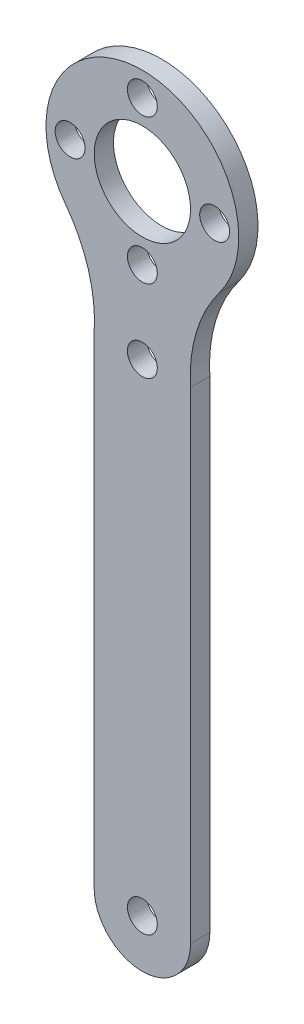
from build123d import *

# Parameters (mm, degrees)
SKETCH_1_R      = 1.55
SKETCH_1_R_2    = 5
EXTRUDE_1_DEPTH = 2


with BuildPart() as part:
    # 草图1 → 凸台-拉伸1 (new body)
    with BuildSketch(Plane.XY):
        with BuildLine():
            Line((-5, 25), (-5, -25))
            ThreePointArc((-5, -25), (0, -30), (5, -25))
            Line((5, -25), (5, 25))
            ThreePointArc((5, 25), (5.598988732, 30.259631636), (7.987721006, 34.983662814))
            ThreePointArc((7.987721006, 34.983662814), (0, 51), (-7.987721006, 34.983662814))
            ThreePointArc((-7.987721006, 34.983662814), (-5.598988732, 30.259631636), (-5, 25))
        make_face()
        with Locations((0, -25)):
            Circle(SKETCH_1_R, mode=Mode.SUBTRACT)
        with Locations((0, 25)):
            Circle(SKETCH_1_R, mode=Mode.SUBTRACT)
        with Locations((7.5, 41)):
            Circle(SKETCH_1_R, mode=Mode.SUBTRACT)
        with Locations((-7.5, 41)):
            Circle(SKETCH_1_R, mode=Mode.SUBTRACT)
        with Locations((0, 33.5)):
            Circle(SKETCH_1_R, mode=Mode.SUBTRACT)
        with Locations((0, 41)):
            Circle(SKETCH_1_R_2, mode=Mode.SUBTRACT)
        with Locations((0, 48.5)):
            Circle(SKETCH_1_R, mode=Mode.SUBTRACT)
    extrude(amount=EXTRUDE_1_DEPTH)


solid = part.part
